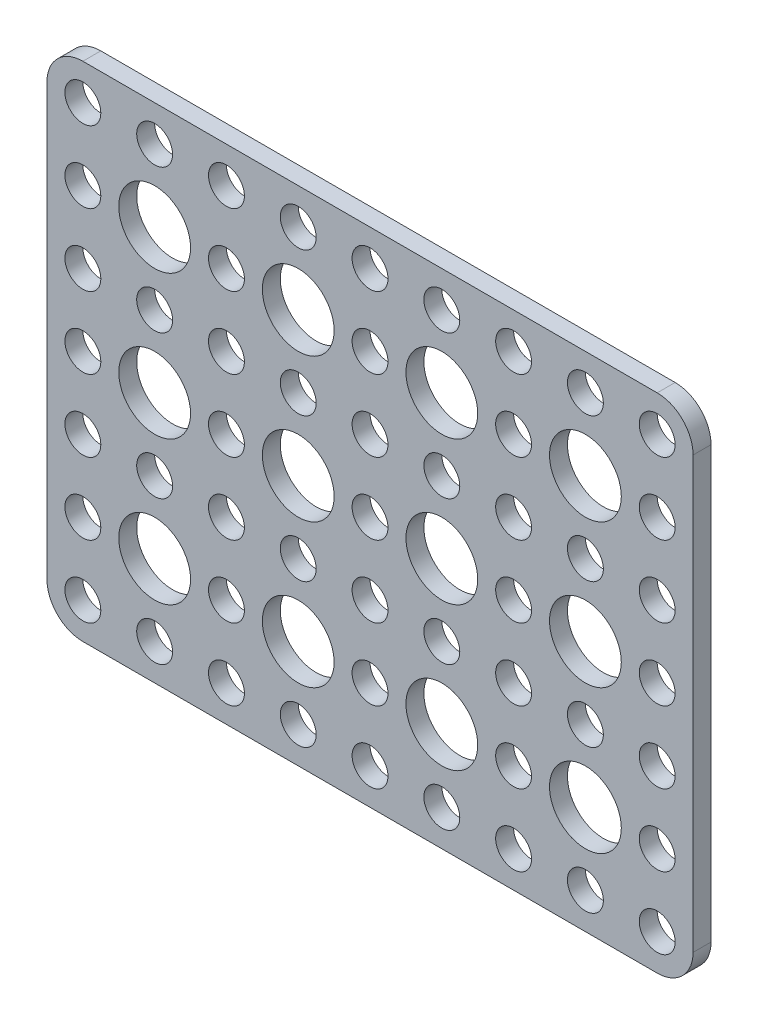
from build123d import *

# Parameters (mm, degrees)
SKETCH1_W            = 72
SKETCH1_H            = 56
BOSS_EXTRUDE1_DEPTH  = 2
SKETCH2_R            = 2
CUT_EXTRUDE1_DEPTH   = 3
LPATTERN1_COUNT      = 9
LPATTERN1_PITCH      = 8
LPATTERN1_COUNT_DIR2 = 7
LPATTERN1_PITCH_DIR2 = 8
SKETCH4_R            = 4
CUT_EXTRUDE2_DEPTH   = 3
LPATTERN2_COUNT      = 4
LPATTERN2_PITCH      = 16
LPATTERN2_COUNT_DIR2 = 3
LPATTERN2_PITCH_DIR2 = 16
FILLET1_R            = 4


with BuildPart() as part:
    # Sketch1 → Boss-Extrude1 (new body)
    with BuildSketch(Plane.XY):
        Rectangle(SKETCH1_W, SKETCH1_H)
    extrude(amount=BOSS_EXTRUDE1_DEPTH)

    # Sketch2 → Cut-Extrude1 (cut)
    with BuildSketch(Plane.XY.offset(2)):
        with Locations((-32, 24)):
            Circle(SKETCH2_R)
    cut_extrude1 = extrude(amount=-CUT_EXTRUDE1_DEPTH, mode=Mode.SUBTRACT)

    # LPattern1: Cut-Extrude1 9 × 7
    with Locations(*[(i * LPATTERN1_PITCH, -j * LPATTERN1_PITCH_DIR2, 0) for i in range(LPATTERN1_COUNT) for j in range(LPATTERN1_COUNT_DIR2) if (i, j) != (0, 0)]):
        add(cut_extrude1, mode=Mode.SUBTRACT)

    # Sketch4 → Cut-Extrude2 (cut)
    with BuildSketch(Plane.XY.offset(2)):
        with Locations((-24, 16)):
            Circle(SKETCH4_R)
    cut_extrude2 = extrude(amount=-CUT_EXTRUDE2_DEPTH, mode=Mode.SUBTRACT)

    # LPattern2: Cut-Extrude2 4 × 3
    with Locations(*[(i * LPATTERN2_PITCH, -j * LPATTERN2_PITCH_DIR2, 0) for i in range(LPATTERN2_COUNT) for j in range(LPATTERN2_COUNT_DIR2) if (i, j) != (0, 0)]):
        add(cut_extrude2, mode=Mode.SUBTRACT)

    # Fillet1
    fillet1_edges = [part.edges().sort_by_distance(p)[0] for p in [
        (36, -28, 1),
        (-36, -28, 1),
        (-36, 28, 1),
        (36, 28, 1),
    ]]
    fillet(fillet1_edges, radius=FILLET1_R)


solid = part.part
